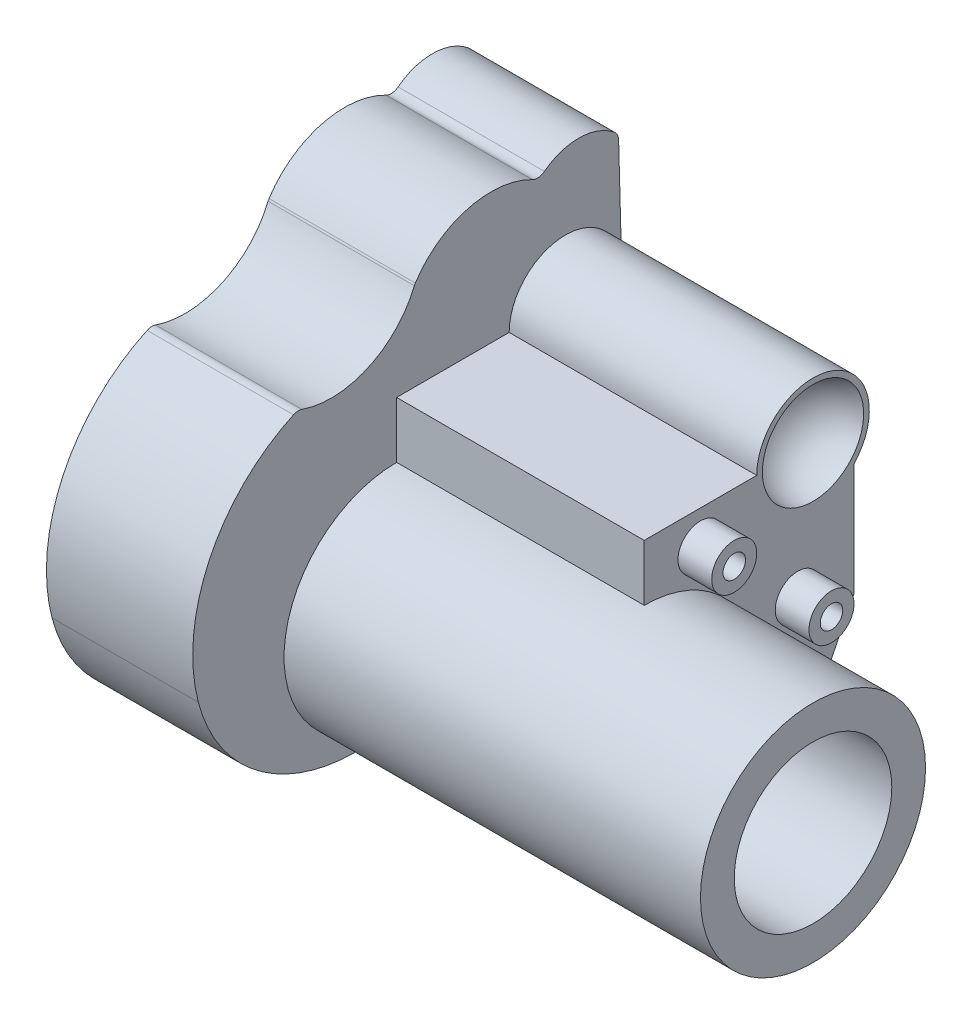
from build123d import *

# Parameters (mm, degrees)
SKETCH1_R           = 10
BOSS_EXTRUDE1_DEPTH = 50
BOSS_EXTRUDE3_DEPTH = 35
SKETCH8_R           = 2
SKETCH8_R_2         = 1
BOSS_EXTRUDE4_DEPTH = 3
BOSS_EXTRUDE6_DEPTH = 13
FILLET1_R           = 1
FILLET2_R           = 1
SKETCH2_R           = 7
CUT_EXTRUDE2_DEPTH  = 61.180591


with BuildPart() as part:
    # Sketch1 → Boss-Extrude1 (new body)
    with BuildSketch(Plane(origin=(0, 0, 0), x_dir=(0, 0, -1), z_dir=(1, 0, 0))):
        Circle(SKETCH1_R)
    extrude(amount=-BOSS_EXTRUDE1_DEPTH)

    # Sketch3 → Boss-Extrude3 (add)
    with BuildSketch(Plane(origin=(-50, 0, 0), x_dir=(0, 0, -1), z_dir=(1, 0, 0))):
        with BuildLine():
            Line((0, 10), (0, 15))
            Line((0, 15), (10, 15))
            ThreePointArc((10, 15), (16.842071907, 19.648308412), (18.642708436, 11.574992664))
            Line((18.642708436, 11.574992664), (18.642708436, 1.574992664))
            Line((18.642708436, 1.574992664), (16.642708436, -2.425007336))
            Line((16.642708436, -2.425007336), (16.642708436, -9.997750449))
            ThreePointArc((16.642708436, -9.997750449), (13.321760405, -11.198307119), (10, -10))
            Line((10, -10), (0, -10))
            Line((0, -10), (0, 10))
        make_face()
    extrude(amount=BOSS_EXTRUDE3_DEPTH)

    # Sketch6 → Cut-Revolve1 (revolve, cut)
    with BuildSketch(Plane(origin=(-15, 0, 0), x_dir=(0, 0, -1), z_dir=(1, 0, 0))):
        with BuildLine():
            Line((13.321760405, -1.448307119), (13.321760405, -10.948307119))
            ThreePointArc((13.321760405, -10.948307119), (18.071760405, -6.198307119), (13.321760405, -1.448307119))
        make_face()
    revolve(axis=Axis((-15, -1.448307119, -13.321760405), (0, -1, 0)), mode=Mode.SUBTRACT)

    # Sketch7 → Cut-Revolve2 (revolve, cut)
    with BuildSketch(Plane(origin=(-15, 0, 0), x_dir=(0, 0, -1), z_dir=(1, 0, 0))):
        with BuildLine():
            Line((15, 10.5), (15, 19.5))
            ThreePointArc((15, 19.5), (19.5, 15), (15, 10.5))
        make_face()
    revolve(axis=Axis((-15, 10.5, -15), (0, 1, 0)), mode=Mode.SUBTRACT)

    # Sketch8 → Boss-Extrude4 (add)
    # profile 1 of 2: a face of its own
    with BuildSketch(Plane(origin=(-15, 0, 0), x_dir=(0, 0, -1), z_dir=(1, 0, 0))):
        with Locations(Location((13.642708436, 3.801692881, 0), (0, 0, 180))):
            Circle(SKETCH8_R)
        with Locations((13.642708436, 3.801692881)):
            Circle(SKETCH8_R_2, mode=Mode.SUBTRACT)
    # profile 2 of 2: a face of its own
    with BuildSketch(Plane(origin=(-15, 0, 0), x_dir=(0, 0, -1), z_dir=(1, 0, 0))):
        with Locations(Location((5, 12, 0), (0, 0, 180))):
            Circle(SKETCH8_R)
        with Locations((5, 12)):
            Circle(SKETCH8_R_2, mode=Mode.SUBTRACT)
    extrude(amount=BOSS_EXTRUDE4_DEPTH)

    # Sketch10 → Boss-Extrude6 (add)
    with BuildSketch(Plane.ZY.offset(50)):
        with BuildLine():
            Line((-19.714603594, 25.400073987), (-19.992475161, 15.274211174))
            ThreePointArc((-19.992475161, 15.274211174), (-14.862842799, 19.998118436), (-10, 15))
            Line((-10, 15), (0, 15))
            Line((0, 15), (0, 10))
            ThreePointArc((0, 10), (10, 0), (0, -10))
            ThreePointArc((0, -10), (10.951955319, -8.476456548), (17.618849286, 0.345053233))
            ThreePointArc((17.618849286, 0.345053233), (16.545732573, 11.017476726), (8.77988791, 18.416386062))
            ThreePointArc((8.77988791, 18.416386062), (2.657537615, 18.500996178), (-1.611789409, 22.889979975))
            ThreePointArc((-1.611789409, 22.889979975), (-6.607805104, 26.429776463), (-12.643535782, 25.400073987))
            ThreePointArc((-12.643535782, 25.400073987), (-16.179069688, 26.864540081), (-19.714603594, 25.400073987))
        make_face()
    extrude(amount=-BOSS_EXTRUDE6_DEPTH)

    # Fillet1
    fillet1_edges = [part.edges().sort_by_distance(p)[0] for p in [
        (-43.5, 25.400073987, -12.643535782),
        (-43.5, 22.889979975, -1.611789409),
        (-43.5, 18.416386062, 8.77988791),
    ]]
    fillet(fillet1_edges, radius=FILLET1_R)

    # Fillet2
    fillet2_edges = [part.edges().sort_by_distance(p)[0] for p in [
        (-43.5, 25.400073987, -19.714603594),
    ]]
    fillet(fillet2_edges, radius=FILLET2_R)

    # Sketch11 → Cut-Revolve3 (revolve, cut)
    with BuildSketch(Plane(origin=(0, 0.559709606, -20.396267082), x_dir=(-1, 0, 0), z_dir=(0, 0.02743144017102401, -0.999623687239425))):
        with BuildLine():
            Line((50, 24.072659381), (50, 15.072659381))
            ThreePointArc((50, 15.072659381), (45.5, 19.572659381), (50, 24.072659381))
        make_face()
    revolve(axis=Axis((-50, 24.623310138, -19.735919367), (0, -0.9996236872394249, -0.027431440171024075)), mode=Mode.SUBTRACT)

    # Sketch2 → Cut-Extrude2 (cut, through all)
    with BuildSketch(Plane(origin=(0, 0, 0), x_dir=(0, 0, -1), z_dir=(1, 0, 0))):
        Circle(SKETCH2_R)
    extrude(amount=-CUT_EXTRUDE2_DEPTH, mode=Mode.SUBTRACT)


solid = part.part
